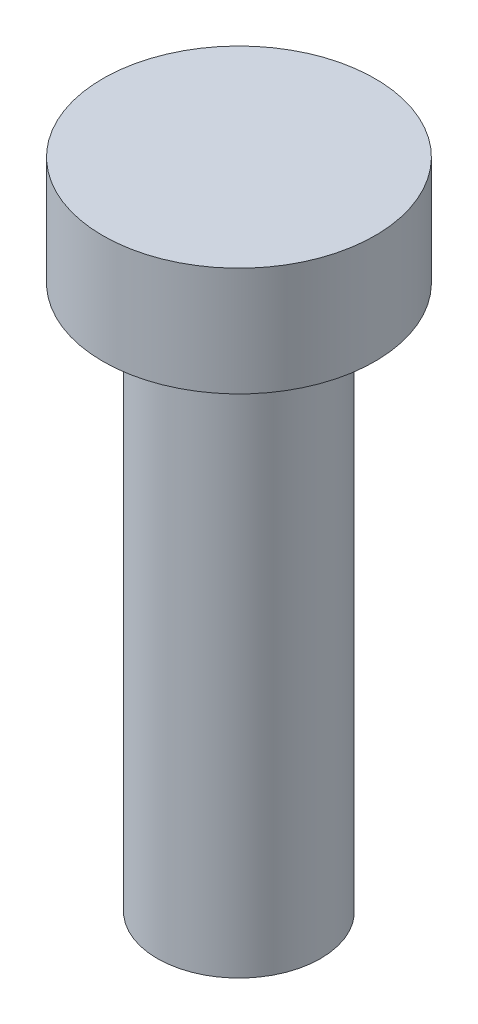
from build123d import *

# Parameters (mm, degrees)
ESQUISSE1_R      = 1.5
EXTRUSION1_DEPTH = 10
ESQUISSE2_R      = 2.5
EXTRUSION2_DEPTH = 2


with BuildPart() as part:
    # Esquisse1 → Extrusion1 (new body)
    with BuildSketch(Plane(origin=(0, 0, 0), x_dir=(1, 0, 0), z_dir=(0, 1, 0))):
        with Locations(Location((0, 0, 0), (0, 0, 270))):
            Circle(ESQUISSE1_R)
    extrude(amount=EXTRUSION1_DEPTH)

    # Esquisse2 → Extrusion2 (add)
    with BuildSketch(Plane(origin=(0, 10, 0), x_dir=(1, 0, 0), z_dir=(0, 1, 0))):
        with Locations(Location((0, 0, 0), (0, 0, 270))):
            Circle(ESQUISSE2_R)
    extrude(amount=EXTRUSION2_DEPTH)


solid = part.part
